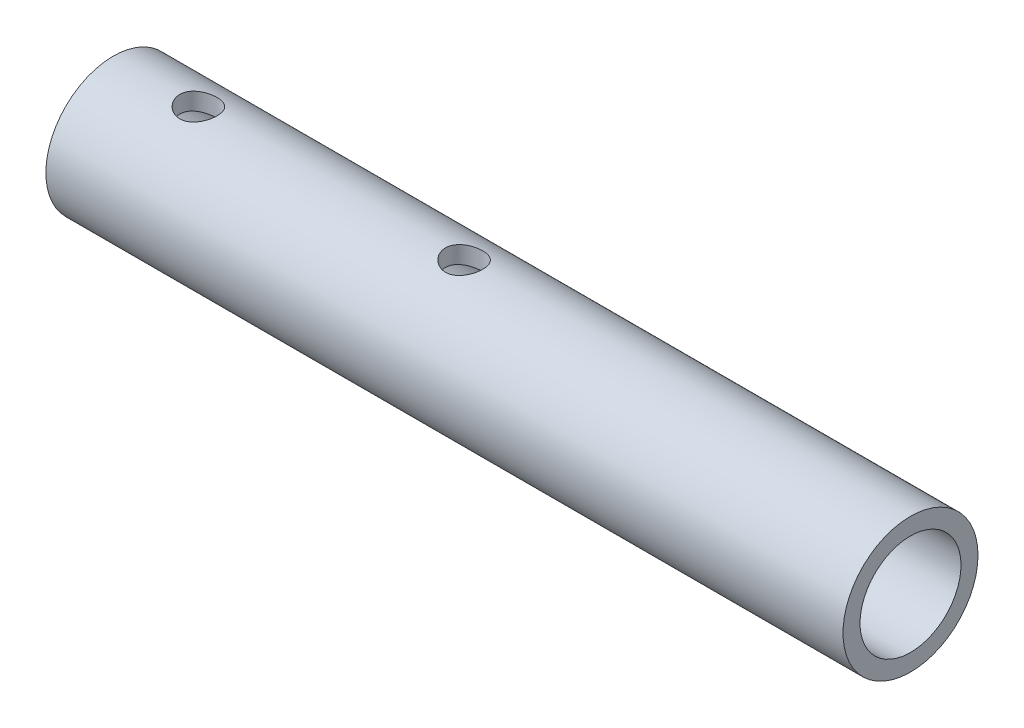
from build123d import *

# Parameters (mm, degrees)
SKETCH1_R               = 6.35
SKETCH1_R_2             = 4.75
BOSS_EXTRUDE1_DEPTH     = 75
CUT_EXTRUDE1_REACH      = 78.332
CUT_EXTRUDE1_END_RADIUS = 4.75
SKETCH2_R               = 1.75


with BuildPart() as part:
    # Sketch1 → Boss-Extrude1 (new body)
    with BuildSketch(Plane(origin=(0, 0, 0), x_dir=(0, 0, -1), z_dir=(1, 0, 0))):
        Circle(SKETCH1_R)
        Circle(SKETCH1_R_2, mode=Mode.SUBTRACT)
    extrude(amount=BOSS_EXTRUDE1_DEPTH)

    # Cut-Extrude1: up to this cylinder (the profile starts outside it)
    cut_extrude1_end = Plane(origin=(20.5, 0, 0), z_dir=(-1, 0, 0)) * Cylinder(CUT_EXTRUDE1_END_RADIUS, 192.164, mode=Mode.PRIVATE)
    # Sketch2 → Cut-Extrude1 (cut, up to the surface)
    with BuildSketch(Plane(origin=(0, 6.35, 0), x_dir=(1, 0, 0), z_dir=(0, 1, 0)), mode=Mode.PRIVATE) as cut_extrude1_sk1:
        with Locations(Location((8, 0, 0), (0, 0, 270))):
            Circle(SKETCH2_R)
    cut_extrude1_tool1 = extrude(cut_extrude1_sk1.sketch, amount=-CUT_EXTRUDE1_REACH, mode=Mode.PRIVATE) - cut_extrude1_end
    add(cut_extrude1_tool1.solids().sort_by_distance((8, 6.35, 0))[0], mode=Mode.SUBTRACT)
    # Sketch2 → Cut-Extrude1 (cut, up to the surface)
    with BuildSketch(Plane(origin=(0, 6.35, 0), x_dir=(1, 0, 0), z_dir=(0, 1, 0)), mode=Mode.PRIVATE) as cut_extrude1_sk2:
        with Locations(Location((33, 0, 0), (0, 0, 270))):
            Circle(SKETCH2_R)
    cut_extrude1_tool2 = extrude(cut_extrude1_sk2.sketch, amount=-CUT_EXTRUDE1_REACH, mode=Mode.PRIVATE) - cut_extrude1_end
    add(cut_extrude1_tool2.solids().sort_by_distance((33, 6.35, 0))[0], mode=Mode.SUBTRACT)


solid = part.part
